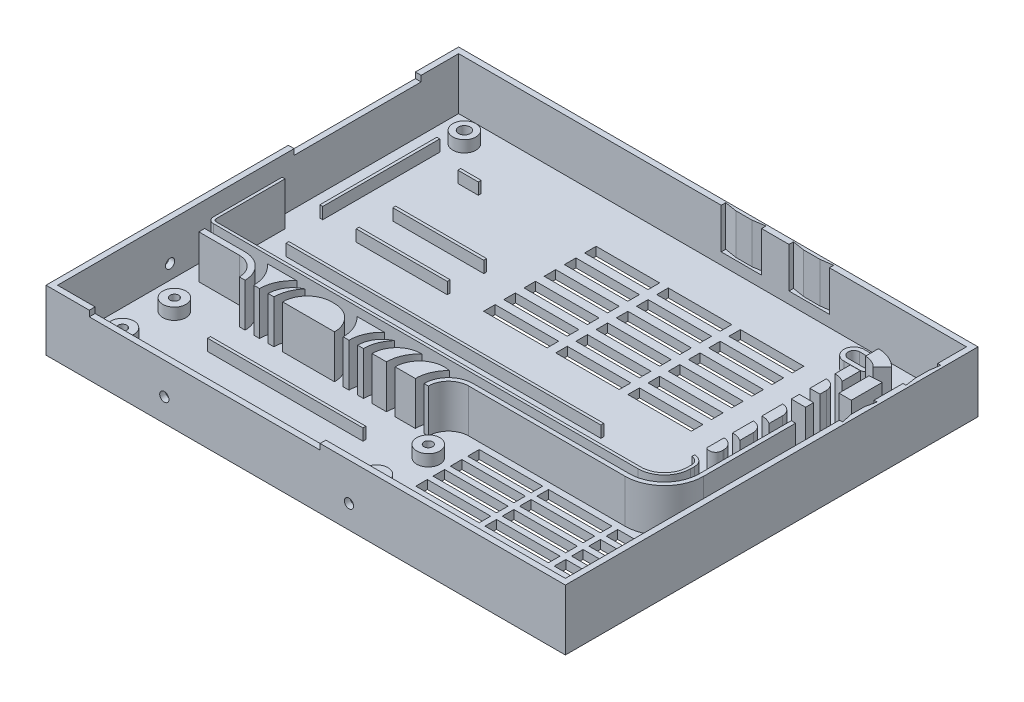
from build123d import *

# Parameters (mm, degrees)
BOTTOM_W                    = 180
BOTTOM_H                    = 143
BOTTOM_R                    = 2
BOSS_BOTTOM_DEPTH           = 3
PCBMOUNT_R                  = 4
PCBMOUNT_R_2                = 2
PCBMOUNT_R_3                = 1.5
PCBMOUNT_W                  = 53.826441334
PCBMOUNT_H                  = 1
PCBMOUNT_W_2                = 109.120876522
PCBMOUNT_W_3                = 31.561867873
PCBMOUNT_W_4                = 1
PCBMOUNT_H_2                = 40.56334633
PCBMOUNT_W_5                = 7.09530363
BOSS_PCBMOUNT_DEPTH         = 4
SIDES_W                     = 180
SIDES_H                     = 143
SIDES_W_2                   = 176
SIDES_H_2                   = 139
BOSS_SIDES_DEPTH            = 18
CABLEPATH_W                 = 4.962557526
CABLEPATH_H                 = 2.804925767
BOSS_CABLEPATH_DEPTH        = 18
EXTRUDERCABLES_W            = 80
EXTRUDERCABLES_H            = 2
CUT_EXTRUDERCABLES_DEPTH    = 2
LCD_W                       = 44
LCD_H                       = 2
CUT_LCD_DEPTH               = 2
CUT_USB_DEPTH               = 14
CUT_EXTRUDE1_DEPTH          = 12
AIROUT_W                    = 22
AIROUT_H                    = 4
CUT_AIROUT_DEPTH            = 10
SHORTMOUNTFARSIDE_R         = 1.6
CUT_SHORTMOUNTFARSIDE_DEPTH = 2
LONGMOUNTLEFTSIDE_R         = 1.6
CUT_LONGMOUNTLEFTSIDE_DEPTH = 2


with BuildPart() as part:
    # Bottom → Boss-Bottom (new body)
    with BuildSketch(Plane(origin=(0, 0, 0), x_dir=(1, 0, 0), z_dir=(0, 1, 0))):
        with Locations((10.5, -23.5)):
            Rectangle(BOTTOM_W, BOTTOM_H)
        with Locations(Location((-67.5, 38, 0), (0, 0, 270))):
            Circle(BOTTOM_R, mode=Mode.SUBTRACT)
        with BuildLine():
            Line((67.653846154, -36.005925939), (72.838438713, -36.405925939))
            ThreePointArc((72.838438713, -36.405925939), (74.67866662, -38.553846154), (72.530746405, -40.394074061))
            Line((72.530746405, -40.394074061), (67.346153846, -39.994074061))
            ThreePointArc((67.346153846, -39.994074061), (65.505925939, -37.846153846), (67.653846154, -36.005925939))
        make_face(mode=Mode.SUBTRACT)
        with BuildLine():
            Line((67.5, 36), (72.7, 36))
            ThreePointArc((72.7, 36), (74.7, 38), (72.7, 40))
            Line((72.7, 40), (67.5, 40))
            ThreePointArc((67.5, 40), (65.5, 38), (67.5, 36))
        make_face(mode=Mode.SUBTRACT)
        with BuildLine():
            Line((-65.5, -38), (-65.5, -38.4))
            ThreePointArc((-65.5, -38.4), (-67.5, -40.4), (-69.5, -38.4))
            Line((-69.5, -38.4), (-69.5, -38))
            ThreePointArc((-69.5, -38), (-67.5, -36), (-65.5, -38))
        make_face(mode=Mode.SUBTRACT)
    extrude(amount=BOSS_BOTTOM_DEPTH)

    # PCBmount → Boss-PCBmount (add)
    # profile 1 of 14: a face of its own
    with BuildSketch(Plane(origin=(0, 3, 0), x_dir=(1, 0, 0), z_dir=(0, 1, 0))):
        with Locations(Location((-67.5, 38, 0), (0, 0, 270))):
            Circle(PCBMOUNT_R)
        with Locations(Location((-67.5, 38, 0), (0, 0, 270))):
            Circle(PCBMOUNT_R_2, mode=Mode.SUBTRACT)
    # profile 2 of 14: a face of its own
    with BuildSketch(Plane(origin=(0, 3, 0), x_dir=(1, 0, 0), z_dir=(0, 1, 0))):
        with Locations(Location((-67.5, -62.5, 0), (0, 0, 270))):
            Circle(PCBMOUNT_R)
        with Locations(Location((-67.5, -62.5, 0), (0, 0, 270))):
            Circle(PCBMOUNT_R_3, mode=Mode.SUBTRACT)
    # profile 3 of 14: a face of its own
    with BuildSketch(Plane(origin=(0, 3, 0), x_dir=(1, 0, 0), z_dir=(0, 1, 0))):
        with Locations(Location((-67.5, -80.5, 0), (0, 0, 270))):
            Circle(PCBMOUNT_R)
        with Locations(Location((-67.5, -80.5, 0), (0, 0, 270))):
            Circle(PCBMOUNT_R_3, mode=Mode.SUBTRACT)
    # profile 4 of 14: a face of its own
    with BuildSketch(Plane(origin=(0, 3, 0), x_dir=(1, 0, 0), z_dir=(0, 1, 0))):
        with Locations(Location((20.5, -80.5, 0), (0, 0, 270))):
            Circle(PCBMOUNT_R)
        with Locations(Location((20.5, -80.5, 0), (0, 0, 270))):
            Circle(PCBMOUNT_R_3, mode=Mode.SUBTRACT)
    # profile 5 of 14: a face of its own
    with BuildSketch(Plane(origin=(0, 3, 0), x_dir=(1, 0, 0), z_dir=(0, 1, 0))):
        with Locations(Location((20.5, -62.5, 0), (0, 0, 270))):
            Circle(PCBMOUNT_R)
        with Locations(Location((20.5, -62.5, 0), (0, 0, 270))):
            Circle(PCBMOUNT_R_3, mode=Mode.SUBTRACT)
    # profile 6 of 14: a face of its own
    with BuildSketch(Plane(origin=(0, 3, 0), x_dir=(1, 0, 0), z_dir=(0, 1, 0))):
        with Locations((-22.662863264, -68.40693012)):
            Rectangle(PCBMOUNT_W, PCBMOUNT_H)
    # profile 7 of 14: a face of its own
    with BuildSketch(Plane(origin=(0, 3, 0), x_dir=(1, 0, 0), z_dir=(0, 1, 0))):
        with Locations((-9.940249858, -26.314610493)):
            Rectangle(PCBMOUNT_W_2, PCBMOUNT_H)
    # profile 8 of 14: a face of its own
    with BuildSketch(Plane(origin=(0, 3, 0), x_dir=(1, 0, 0), z_dir=(0, 1, 0))):
        with Locations((-40.890453625, -9.827206513)):
            Rectangle(PCBMOUNT_W_3, PCBMOUNT_H)
    # profile 9 of 14: a face of its own
    with BuildSketch(Plane(origin=(0, 3, 0), x_dir=(1, 0, 0), z_dir=(0, 1, 0))):
        with Locations((-40.890453625, 2.844807151)):
            Rectangle(PCBMOUNT_W_3, PCBMOUNT_H)
    # profile 10 of 14: a face of its own
    with BuildSketch(Plane(origin=(0, 3, 0), x_dir=(1, 0, 0), z_dir=(0, 1, 0))):
        with Locations((-69.68456172, 10.871887931)):
            Rectangle(PCBMOUNT_W_4, PCBMOUNT_H_2)
    # profile 11 of 14: a face of its own
    with BuildSketch(Plane(origin=(0, 3, 0), x_dir=(1, 0, 0), z_dir=(0, 1, 0))):
        with Locations((-53.123735746, 25.391793518)):
            Rectangle(PCBMOUNT_W_5, PCBMOUNT_H)
    # profile 12 of 14: a face of its own
    with BuildSketch(Plane(origin=(0, 3, 0), x_dir=(1, 0, 0), z_dir=(0, 1, 0))):
        with BuildLine():
            Line((-64, -38), (-64, -38.4))
            ThreePointArc((-64, -38.4), (-67.5, -41.9), (-71, -38.4))
            Line((-71, -38.4), (-71, -38))
            ThreePointArc((-71, -38), (-67.5, -34.5), (-64, -38))
        make_face()
        with BuildLine():
            Line((-65.5, -38), (-65.5, -38.4))
            ThreePointArc((-65.5, -38.4), (-67.5, -40.4), (-69.5, -38.4))
            Line((-69.5, -38.4), (-69.5, -38))
            ThreePointArc((-69.5, -38), (-67.5, -36), (-65.5, -38))
        make_face(mode=Mode.SUBTRACT)
    # profile 13 of 14: a face of its own
    with BuildSketch(Plane(origin=(0, 3, 0), x_dir=(1, 0, 0), z_dir=(0, 1, 0))):
        with BuildLine():
            Line((67.5, 34.5), (72.7, 34.5))
            ThreePointArc((72.7, 34.5), (76.2, 38), (72.7, 41.5))
            Line((72.7, 41.5), (67.5, 41.5))
            ThreePointArc((67.5, 41.5), (64, 38), (67.5, 34.5))
        make_face()
        with BuildLine():
            Line((67.5, 36), (72.7, 36))
            ThreePointArc((72.7, 36), (74.7, 38), (72.7, 40))
            Line((72.7, 40), (67.5, 40))
            ThreePointArc((67.5, 40), (65.5, 38), (67.5, 36))
        make_face(mode=Mode.SUBTRACT)
    # profile 14 of 14: a face of its own
    with BuildSketch(Plane(origin=(0, 3, 0), x_dir=(1, 0, 0), z_dir=(0, 1, 0))):
        with BuildLine():
            Line((67.769230769, -34.510370393), (72.953823328, -34.910370393))
            ThreePointArc((72.953823328, -34.910370393), (76.174222166, -38.669230769), (72.415361789, -41.889629607))
            Line((72.415361789, -41.889629607), (67.230769231, -41.489629607))
            ThreePointArc((67.230769231, -41.489629607), (64.010370393, -37.730769231), (67.769230769, -34.510370393))
        make_face()
        with BuildLine():
            Line((67.653846154, -36.005925939), (72.838438713, -36.405925939))
            ThreePointArc((72.838438713, -36.405925939), (74.67866662, -38.553846154), (72.530746405, -40.394074061))
            Line((72.530746405, -40.394074061), (67.346153846, -39.994074061))
            ThreePointArc((67.346153846, -39.994074061), (65.505925939, -37.846153846), (67.653846154, -36.005925939))
        make_face(mode=Mode.SUBTRACT)
    extrude(amount=BOSS_PCBMOUNT_DEPTH)

    # Sides → Boss-Sides (add)
    with BuildSketch(Plane(origin=(0, 3, 0), x_dir=(1, 0, 0), z_dir=(0, 1, 0))):
        with Locations((10.5, -23.5)):
            Rectangle(SIDES_W, SIDES_H)
        with Locations((10.5, -23.5)):
            Rectangle(SIDES_W_2, SIDES_H_2, mode=Mode.SUBTRACT)
    extrude(amount=BOSS_SIDES_DEPTH)

    # CablePath → Boss-CablePath (add)
    with BuildSketch(Plane(origin=(0, 0, 0), x_dir=(1, 0, 0), z_dir=(0, 1, 0))):
        with BuildLine():
            Line((-10.5, -56), (-8.5, -56))
            ThreePointArc((-8.5, -56), (-7.723805295, -51.846688069), (-5.5, -48.254033308))
            ThreePointArc((-5.5, -48.254033308), (-9.141428429, -51.390227771), (-10.5, -56))
        make_face()
        with BuildLine():
            Line((-58, -44.5), (-72.022171108, -44.5))
            ThreePointArc((-72.022171108, -44.5), (-73.42070733, -43.92070733), (-74, -42.522171108))
            Line((-74, -42.522171108), (-74, -18.678908605))
            Line((-74, -18.678908605), (-73, -18.678908605))
            Line((-73, -18.678908605), (-73, -42.522171108))
            ThreePointArc((-73, -42.522171108), (-72.713600548, -43.213600548), (-72.022171108, -43.5))
            Line((-72.022171108, -43.5), (-58, -43.5))
            Line((-58, -43.5), (-33, -43.5))
            Line((-33, -43.5), (75.163720941, -43.5))
            ThreePointArc((75.163720941, -43.5), (80.920301546, -41.115546241), (83.304755306, -35.358965636))
            Line((83.304755306, -35.358965636), (83.304755306, -34))
            ThreePointArc((83.304755306, -34), (82.572522259, -32.232233047), (80.804755306, -31.5))
            Line((80.804755306, -31.5), (80.804755306, -30.5))
            ThreePointArc((80.804755306, -30.5), (83.27962904, -31.525126266), (84.304755306, -34))
            Line((84.304755306, -34), (84.304755306, -35.358965636))
            ThreePointArc((84.304755306, -35.358965636), (81.627408327, -41.822653022), (75.163720941, -44.5))
            Line((75.163720941, -44.5), (-33, -44.5))
            Line((-33, -44.5), (-58, -44.5))
        make_face()
        with BuildLine():
            Line((84.304755306, -3.52), (84.304755306, -8.202774425))
            ThreePointArc((84.304755306, -8.202774425), (82.627943963, -7.440930909), (80.804755306, -7.18))
            Line((80.804755306, -7.18), (80.804755306, -0.02))
            ThreePointArc((80.804755306, -0.02), (83.27962904, -1.045126266), (84.304755306, -3.52))
        make_face()
        with BuildLine():
            Line((87.304755306, -3.52), (87.304755306, -35.358965636))
            ThreePointArc((87.304755306, -35.358965636), (83.748728671, -43.943973365), (75.163720941, -47.5))
            Line((75.163720941, -47.5), (21, -47.5))
            ThreePointArc((21, -47.5), (14.98959236, -49.98959236), (12.5, -56))
            Line((12.5, -56), (14, -56))
            ThreePointArc((14, -56), (16.050252532, -51.050252532), (21, -49))
            Line((21, -49), (75.163720941, -49))
            ThreePointArc((75.163720941, -49), (84.809388843, -45.004633537), (88.804755306, -35.358965636))
            Line((88.804755306, -35.358965636), (88.804755306, -3.52))
            Line((88.804755306, -3.52), (87.304755306, -3.52))
        make_face()
        with BuildLine():
            Line((84.304755306, -13.68), (84.304755306, -18.362774425))
            ThreePointArc((84.304755306, -18.362774425), (82.627943963, -17.600930909), (80.804755306, -17.34))
            Line((80.804755306, -17.34), (80.804755306, -10.18))
            ThreePointArc((80.804755306, -10.18), (83.27962904, -11.205126266), (84.304755306, -13.68))
        make_face()
        with BuildLine():
            Line((84.304755306, -23.84), (84.304755306, -24.21653708))
            ThreePointArc((84.304755306, -24.21653708), (83.262046424, -26.446786084), (80.804755306, -26.295218323))
            Line((80.804755306, -26.295218323), (80.804755306, -20.34))
            ThreePointArc((80.804755306, -20.34), (83.27962904, -21.365126266), (84.304755306, -23.84))
        make_face()
        with BuildLine():
            Line((-27.897556372, -47.499892591), (-26.898988601, -47.499892591))
            ThreePointArc((-26.898988601, -47.499892591), (-20.95394296, -50.025160348), (-18.5, -56))
            Line((-18.5, -56), (-36.5, -56))
            ThreePointArc((-36.5, -56), (-33.974123538, -49.953226845), (-27.897556372, -47.499892591))
        make_face()
        with BuildLine():
            Line((2.5, -56), (9.5, -56))
            ThreePointArc((9.5, -56), (10.411090708, -51.513910389), (13, -47.738644179))
            ThreePointArc((13, -47.738644179), (5.74405099, -49.319805392), (2.5, -56))
        make_face()
        with BuildLine():
            Line((-41.5, -56), (-39.5, -56))
            ThreePointArc((-39.5, -56), (-38.723922218, -51.846856157), (-36.500429607, -48.254227439))
            ThreePointArc((-36.500429607, -48.254227439), (-40.141556261, -51.390425815), (-41.5, -56))
        make_face()
        with Locations((83.286034069, 4.382462884)):
            Rectangle(CABLEPATH_W, CABLEPATH_H)
        with BuildLine():
            Line((-58, -47.5), (-72.022171108, -47.5))
            Line((-72.022171108, -47.5), (-72.022171108, -49.5))
            Line((-72.022171108, -49.5), (-58, -49.5))
            ThreePointArc((-58, -49.5), (-53.403805922, -51.403805922), (-51.5, -56))
            Line((-51.5, -56), (-49.5, -56))
            ThreePointArc((-49.5, -56), (-51.98959236, -49.98959236), (-58, -47.5))
        make_face()
        with BuildLine():
            Line((-46.5, -56), (-44.5, -56))
            ThreePointArc((-44.5, -56), (-43.419208989, -51.132753957), (-40.379985384, -47.180373266))
            Line((-40.379985384, -47.180373266), (-50.620014616, -47.180373266))
            ThreePointArc((-50.620014616, -47.180373266), (-47.580791011, -51.132753957), (-46.5, -56))
        make_face()
        with BuildLine():
            Line((-19.253686287, -47.5), (-9.745966692, -47.5))
            ThreePointArc((-9.745966692, -47.5), (-12.519710475, -51.353959587), (-13.5, -56))
            Line((-13.5, -56), (-15.5, -56))
            ThreePointArc((-15.5, -56), (-16.480191842, -51.354029683), (-19.253686287, -47.5))
        make_face()
        with BuildLine():
            Line((3, -47.5), (3.254033308, -47.5))
            ThreePointArc((3.254033308, -47.5), (0.480289525, -51.353959587), (-0.5, -56))
            Line((-0.5, -56), (-5.5, -56))
            ThreePointArc((-5.5, -56), (-3.01040764, -49.98959236), (3, -47.5))
        make_face()
        with BuildLine():
            Line((80.804755306, 33.19173386), (80.804755306, 28.69173386))
            ThreePointArc((80.804755306, 28.69173386), (83.30407388, 28.192017742), (85.419100215, 26.769705141))
            Line((85.419100215, 26.769705141), (88.582929899, 29.969908453))
            ThreePointArc((88.582929899, 29.969908453), (85.014273062, 32.354408717), (80.804755306, 33.19173386))
        make_face()
        Polygon((87.304755306, 13.016584072), (87.304755306, 23.442070203), (91.580364703, 23.723552605), (91.580364703, 13.016584072), align=None)
        with BuildLine():
            Line((84.306468509, 23.442070203), (84.305549191, 17.100037684))
            ThreePointArc((84.305549191, 17.100037684), (82.628396134, 17.86225643), (80.804755306, 18.123319491))
            Line((80.804755306, 18.123319491), (80.804755306, 23.442070203))
            Line((80.804755306, 23.442070203), (84.306468509, 23.442070203))
        make_face()
        with BuildLine():
            Line((84.30443569, 9.418411237), (80.804755306, 9.418411237))
            Line((80.804755306, 9.418411237), (80.804755306, 15.123319491))
            ThreePointArc((80.804755306, 15.123319491), (83.27962904, 14.098193225), (84.304755306, 11.623319491))
            Line((84.304755306, 11.623319491), (84.30443569, 9.418411237))
        make_face()
    extrude(amount=BOSS_CABLEPATH_DEPTH)

    # ExtruderCables → Cut-ExtruderCables (cut)
    with BuildSketch(Plane.XY.offset(95)):
        with Locations((-24.5, 20)):
            Rectangle(EXTRUDERCABLES_W, EXTRUDERCABLES_H)
    extrude(amount=-CUT_EXTRUDERCABLES_DEPTH, mode=Mode.SUBTRACT)

    # LCD → Cut-LCD (cut)
    with BuildSketch(Plane.ZY.offset(79.5)):
        with Locations((-11, 20)):
            Rectangle(LCD_W, LCD_H)
    extrude(amount=-CUT_LCD_DEPTH, mode=Mode.SUBTRACT)

    # USB → Cut-USB (cut)
    with BuildSketch(Plane(origin=(0, 21, 0), x_dir=(1, 0, 0), z_dir=(0, 1, 0))):
        Polygon((37, 46), (51, 46), (51, 47.470717781), (46.794639398, 46.876639119), (41.191271364, 46.876639119), (37, 47.563102225), align=None)
        Polygon((13.5, 47.563102225), (17.691271364, 46.876639119), (23.306669406, 46.876639119), (27.5, 47.550408946), (27.5, 46), (13.5, 46), align=None)
    extrude(amount=-CUT_USB_DEPTH, mode=Mode.SUBTRACT)

    # 24VHeatBed → Cut-Extrude1 (cut)
    with BuildSketch(Plane(origin=(0, 21, 0), x_dir=(1, 0, 0), z_dir=(0, 1, 0))):
        Polygon((98.5, 2), (98.5, 8), (98.5, 14), (99.60045066, 14), (98.79014997, 10.322130668), (98.79014997, 8), (98.79014997, 5.677869332), (99.60045066, 2), align=None)
        Polygon((98.5, 24), (98.49927543, 30), (98.5, 36), (99.570122135, 36), (99.035254912, 32.322130668), (99.035254912, 30), (99.035254912, 27.677869332), (99.570122135, 24), align=None)
    extrude(amount=-CUT_EXTRUDE1_DEPTH, mode=Mode.SUBTRACT)

    # AirOut → Cut-AirOut (cut)
    with BuildSketch(Plane(origin=(0, 3, 0), x_dir=(1, 0, 0), z_dir=(0, 1, 0))):
        with Locations((61.881395262, -89.240458888)):
            Rectangle(AIROUT_W, AIROUT_H)
        with Locations((85.881395262, -89.240458888)):
            Rectangle(AIROUT_W, AIROUT_H)
        with Locations((37.881395262, -89.240458888)):
            Rectangle(AIROUT_W, AIROUT_H)
        with Locations((61.881395262, -83.240458888)):
            Rectangle(AIROUT_W, AIROUT_H)
        with Locations((37.881395262, -83.240458888)):
            Rectangle(AIROUT_W, AIROUT_H)
        with Locations((61.881395262, -77.240458888)):
            Rectangle(AIROUT_W, AIROUT_H)
        with Locations((37.881395262, -77.240458888)):
            Rectangle(AIROUT_W, AIROUT_H)
        with Locations((61.881395262, -71.240458888)):
            Rectangle(AIROUT_W, AIROUT_H)
        with Locations((37.881395262, -71.240458888)):
            Rectangle(AIROUT_W, AIROUT_H)
        with Locations((61.881395262, -65.240458888)):
            Rectangle(AIROUT_W, AIROUT_H)
        with Locations((37.881395262, -65.240458888)):
            Rectangle(AIROUT_W, AIROUT_H)
        with Locations((85.881395262, -83.240458888)):
            Rectangle(AIROUT_W, AIROUT_H)
        with Locations((85.881395262, -77.240458888)):
            Rectangle(AIROUT_W, AIROUT_H)
        with Locations((85.881395262, -71.240458888)):
            Rectangle(AIROUT_W, AIROUT_H)
        with Locations((85.881395262, -65.240458888)):
            Rectangle(AIROUT_W, AIROUT_H)
        with Locations((85.881395262, -59.240458888)):
            Rectangle(AIROUT_W, AIROUT_H)
        with Locations((61.881395262, -59.240458888)):
            Rectangle(AIROUT_W, AIROUT_H)
        with Locations((37.881395262, -59.240458888)):
            Rectangle(AIROUT_W, AIROUT_H)
        with Locations((85.881395262, -53.240458888)):
            Rectangle(AIROUT_W, AIROUT_H)
        with Locations((61.881395262, -53.240458888)):
            Rectangle(AIROUT_W, AIROUT_H)
        with Locations((37.881395262, -53.240458888)):
            Rectangle(AIROUT_W, AIROUT_H)
        with Locations((22.147970252, 28.005745476)):
            Rectangle(AIROUT_W, AIROUT_H)
        with Locations((-2.852029748, 28.005745476)):
            Rectangle(AIROUT_W, AIROUT_H)
        with Locations((47.147970252, 28.005745476)):
            Rectangle(AIROUT_W, AIROUT_H)
        with Locations((22.147970252, 21.005745476)):
            Rectangle(AIROUT_W, AIROUT_H)
        with Locations((47.147970252, 21.005745476)):
            Rectangle(AIROUT_W, AIROUT_H)
        with Locations((22.147970252, 14.005745476)):
            Rectangle(AIROUT_W, AIROUT_H)
        with Locations((47.147970252, 14.005745476)):
            Rectangle(AIROUT_W, AIROUT_H)
        with Locations((22.147970252, 7.005745476)):
            Rectangle(AIROUT_W, AIROUT_H)
        with Locations((47.147970252, 7.005745476)):
            Rectangle(AIROUT_W, AIROUT_H)
        with Locations((22.147970252, 0.005745476)):
            Rectangle(AIROUT_W, AIROUT_H)
        with Locations((47.147970252, 0.005745476)):
            Rectangle(AIROUT_W, AIROUT_H)
        with Locations((22.147970252, -6.994254524)):
            Rectangle(AIROUT_W, AIROUT_H)
        with Locations((47.147970252, -6.994254524)):
            Rectangle(AIROUT_W, AIROUT_H)
        with Locations((-2.852029748, 21.005745476)):
            Rectangle(AIROUT_W, AIROUT_H)
        with Locations((-2.852029748, 14.005745476)):
            Rectangle(AIROUT_W, AIROUT_H)
        with Locations((-2.852029748, 7.005745476)):
            Rectangle(AIROUT_W, AIROUT_H)
        with Locations((-2.852029748, 0.005745476)):
            Rectangle(AIROUT_W, AIROUT_H)
        with Locations((-2.852029748, -6.994254524)):
            Rectangle(AIROUT_W, AIROUT_H)
    extrude(amount=-CUT_AIROUT_DEPTH, mode=Mode.SUBTRACT)

    # ShortMountFarSide → Cut-ShortMountFarSide (cut)
    with BuildSketch(Plane.ZY.offset(79.5)):
        with Locations((16, 8)):
            Circle(SHORTMOUNTFARSIDE_R)
        with Locations((54, 8)):
            Circle(SHORTMOUNTFARSIDE_R)
    extrude(amount=-CUT_SHORTMOUNTFARSIDE_DEPTH, mode=Mode.SUBTRACT)

    # LongMountLeftSide → Cut-LongMountLeftSide (cut)
    with BuildSketch(Plane.XY.offset(95)):
        with Locations((-38.5, 8)):
            Circle(LONGMOUNTLEFTSIDE_R)
        with Locations((25.5, 8)):
            Circle(LONGMOUNTLEFTSIDE_R)
    extrude(amount=-CUT_LONGMOUNTLEFTSIDE_DEPTH, mode=Mode.SUBTRACT)


solid = part.part
